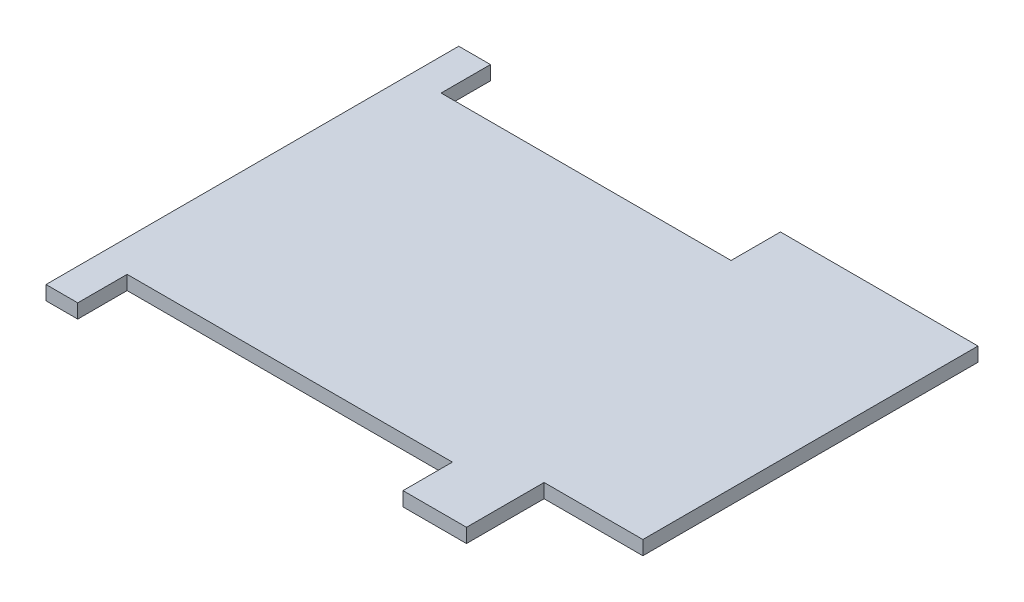
from build123d import *

# Parameters (mm, degrees)
SKETCH_1_W          = 73.6
SKETCH_1_H          = 58.5
EXTRUDE_1_DEPTH     = 2
SKETCH_2_W          = 41.1
SKETCH_2_H          = 7
SKETCH_2_W_2        = 14
SKETCH_2_H_2        = 11
SKETCH_2_W_3        = 46.1
CUT_EXTRUDE_1_DEPTH = 2


with BuildPart() as part:
    # Эскиз1 → Бобышка-Вытянуть1 (new body)
    with BuildSketch(Plane(origin=(0, 0, 0), x_dir=(1, 0, 0), z_dir=(0, 1, 0))):
        with Locations((36.8, -29.25)):
            Rectangle(SKETCH_1_W, SKETCH_1_H)
    extrude(amount=EXTRUDE_1_DEPTH)

    # Эскиз2 → Вырез-Вытянуть1 (cut)
    with BuildSketch(Plane(origin=(0, 2, 0), x_dir=(1, 0, 0), z_dir=(0, 1, 0))):
        with Locations((25.05, -3.5)):
            Rectangle(SKETCH_2_W, SKETCH_2_H)
        with Locations((66.6, -53)):
            Rectangle(SKETCH_2_W_2, SKETCH_2_H_2)
        with Locations((27.55, -55)):
            Rectangle(SKETCH_2_W_3, SKETCH_2_H)
    extrude(amount=-CUT_EXTRUDE_1_DEPTH, mode=Mode.SUBTRACT)


solid = part.part
